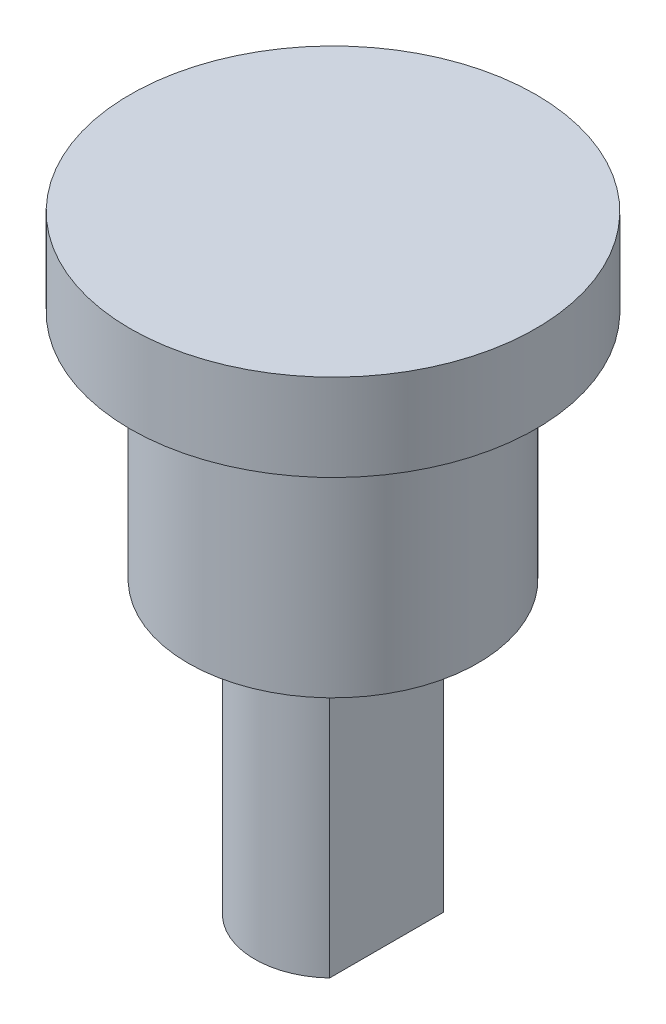
from build123d import *

# Parameters (mm, degrees)
SKETCH1_R           = 7
SKETCH1_R_2         = 5
BOSS_EXTRUDE1_DEPTH = 3
SKETCH1_3_R         = 5
BOSS_EXTRUDE2_DEPTH = 8
BOSS_EXTRUDE3_START = -8
BOSS_EXTRUDE3_DEPTH = 10


with BuildPart() as part:
    # Sketch1 → Boss-Extrude1 (new body)
    # profile 1 of 4: a face of its own
    with BuildSketch(Plane(origin=(0, 0, 0), x_dir=(1, 0, 0), z_dir=(0, 1, 0))):
        with Locations(Location((0, 0, 0), (0, 0, 270))):
            Circle(SKETCH1_R)
        Circle(SKETCH1_R_2, mode=Mode.SUBTRACT)
    # profile 2 of 4: a face of its own
    with BuildSketch(Plane(origin=(0, 0, 0), x_dir=(1, 0, 0), z_dir=(0, 1, 0))):
        Circle(SKETCH1_R_2)
        with BuildLine():
            ThreePointArc((-1.85, -1.966596044), (0, -2.7), (1.85, -1.966596044))
            Line((1.85, -1.966596044), (1.85, 1.966596044))
            ThreePointArc((1.85, 1.966596044), (0, 2.7), (-1.85, 1.966596044))
            Line((-1.85, 1.966596044), (-1.85, -1.966596044))
        make_face(mode=Mode.SUBTRACT)
    # profile 3 of 4: a face of its own
    with BuildSketch(Plane(origin=(0, 0, 0), x_dir=(1, 0, 0), z_dir=(0, 1, 0))):
        with BuildLine():
            Line((1.85, -1.966596044), (1.85, 1.966596044))
            ThreePointArc((1.85, 1.966596044), (0.995035346, 2.509961087), (0, 2.7))
            Line((0, 2.7), (0, -2.7))
            ThreePointArc((0, -2.7), (0.995035346, -2.509961087), (1.85, -1.966596044))
        make_face()
    # profile 4 of 4: a face of its own
    with BuildSketch(Plane(origin=(0, 0, 0), x_dir=(1, 0, 0), z_dir=(0, 1, 0))):
        with BuildLine():
            Line((0, -2.7), (0, 2.7))
            ThreePointArc((0, 2.7), (-0.995035346, 2.509961087), (-1.85, 1.966596044))
            Line((-1.85, 1.966596044), (-1.85, -1.966596044))
            ThreePointArc((-1.85, -1.966596044), (-0.995035346, -2.509961087), (0, -2.7))
        make_face()
    extrude(amount=BOSS_EXTRUDE1_DEPTH)

    # Sketch1<3> → Boss-Extrude2 (add)
    with BuildSketch(Plane(origin=(0, 0, 0), x_dir=(1, 0, 0), z_dir=(0, 1, 0))):
        with Locations(Location((0, 0, 0), (0, 0, 270))):
            Circle(SKETCH1_3_R)
    extrude(amount=-BOSS_EXTRUDE2_DEPTH)

    # Sketch1<5> → Boss-Extrude3 (add)
    with BuildSketch(Plane(origin=(0, 0, 0), x_dir=(1, 0, 0), z_dir=(0, 1, 0)).offset(BOSS_EXTRUDE3_START)):
        with BuildLine():
            Line((0, -2.7), (0, 2.7))
            ThreePointArc((0, 2.7), (-0.995035346, 2.509961087), (-1.85, 1.966596044))
            Line((-1.85, 1.966596044), (-1.85, -1.966596044))
            ThreePointArc((-1.85, -1.966596044), (-0.995035346, -2.509961087), (0, -2.7))
        make_face()
        with BuildLine():
            Line((1.85, -1.966596044), (1.85, 1.966596044))
            ThreePointArc((1.85, 1.966596044), (0.995035346, 2.509961087), (0, 2.7))
            Line((0, 2.7), (0, -2.7))
            ThreePointArc((0, -2.7), (0.995035346, -2.509961087), (1.85, -1.966596044))
        make_face()
    extrude(amount=-BOSS_EXTRUDE3_DEPTH)


solid = part.part
